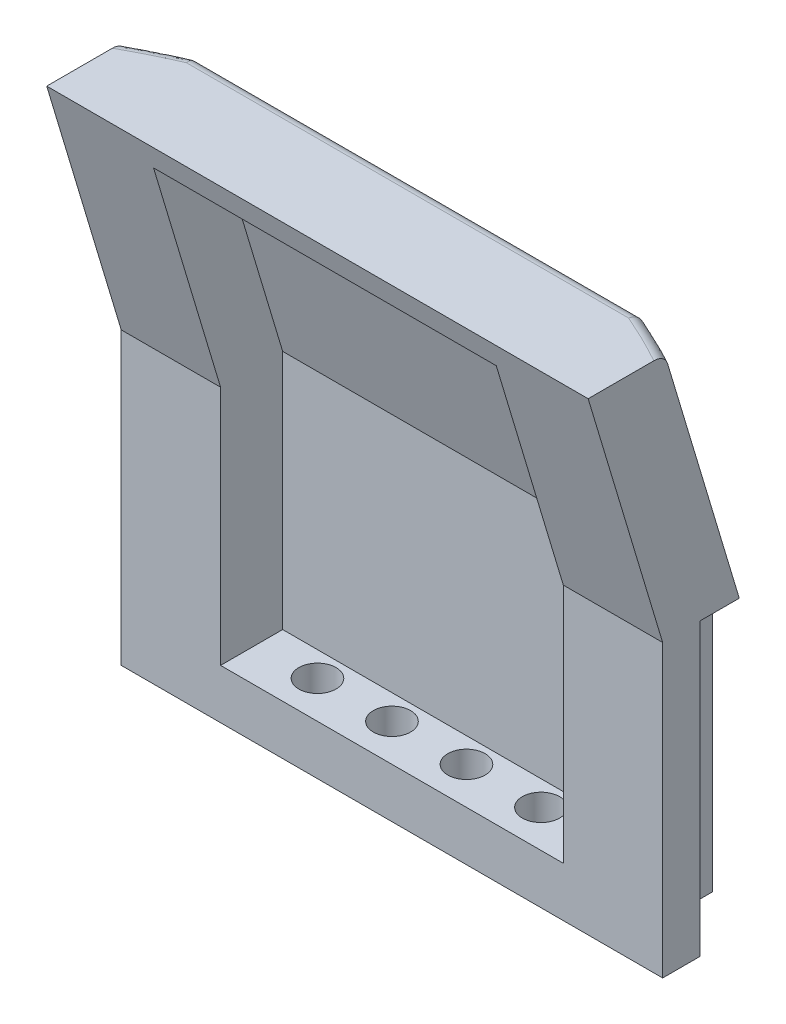
from build123d import *

# Parameters (mm, degrees)
SKETCH1_R                       = 0.75
BOSS_EXTRUDE1_DEPTH             = 1.7
SKETCH1_4_R                     = 1
BOSS_EXTRUDE2_DEPTH             = 0.3
BOSS_EXTRUDE3_DEPTH             = 11.4
BOSS_EXTRUDE4_REACH             = 24.984
CUT_EXTRUDE1_DEPTH              = 15.8
BOSS_EXTRUDE5_DEPTH             = 2
BOSS_EXTRUDE6_DEPTH             = 2
CUT_EXTRUDE4_DEPTH              = 10
CUT_EXTRUDE4_DEPTH_BACK         = 12
BOSS_EXTRUDE7_REACH             = 31.456
BOSS_EXTRUDE7_DIRECTION_2_REACH = 31.456
FILLET1_R                       = 0.5


with BuildPart() as part:
    # Sketch1 → Boss-Extrude1 (new body)
    with BuildSketch(Plane(origin=(0, 0, 0), x_dir=(1, 0, 0), z_dir=(0, 1, 0))):
        Polygon((13.4, 2.5), (-4.4, 2.5), (-4.4, 0), (-6.4, 0), (-6.4, -1.5), (15.4, -1.5), (15.4, 0), (13.4, 0), align=None)
        with Locations(Location((3, 0, 0), (0, 0, 270))):
            Circle(SKETCH1_R, mode=Mode.SUBTRACT)
        with Locations(Location((6, 0, 0), (0, 0, 270))):
            Circle(SKETCH1_R, mode=Mode.SUBTRACT)
        with Locations(Location((9, 0, 0), (0, 0, 270))):
            Circle(SKETCH1_R, mode=Mode.SUBTRACT)
        with Locations(Location((0, 0, 0), (0, 0, 270))):
            Circle(SKETCH1_R, mode=Mode.SUBTRACT)
    extrude(amount=BOSS_EXTRUDE1_DEPTH)

    # Sketch1<4> → Boss-Extrude2 (add)
    with BuildSketch(Plane(origin=(0, 0, 0), x_dir=(1, 0, 0), z_dir=(0, 1, 0))):
        Polygon((13.4, 2.5), (-4.4, 2.5), (-4.4, 0), (-6.4, 0), (-6.4, -1.5), (15.4, -1.5), (15.4, 0), (13.4, 0), align=None)
        with Locations(Location((0, 0, 0), (0, 0, 270))):
            Circle(SKETCH1_4_R, mode=Mode.SUBTRACT)
        with Locations(Location((3, 0, 0), (0, 0, 270))):
            Circle(SKETCH1_4_R, mode=Mode.SUBTRACT)
        with Locations(Location((6, 0, 0), (0, 0, 270))):
            Circle(SKETCH1_4_R, mode=Mode.SUBTRACT)
        with Locations(Location((9, 0, 0), (0, 0, 270))):
            Circle(SKETCH1_4_R, mode=Mode.SUBTRACT)
    extrude(amount=-BOSS_EXTRUDE2_DEPTH)

    # Sketch1<7> → Boss-Extrude3 (add)
    with BuildSketch(Plane(origin=(0, 0, 0), x_dir=(1, 0, 0), z_dir=(0, 1, 0))):
        Polygon((13.4, 1), (13.4, 2.5), (-4.4, 2.5), (-4.4, 1), (-2.4, 1), (0, 1), (3, 1), (6, 1), (9.000000004, 1), (11.4, 1), align=None)
        Polygon((-2.4, 1), (-4.4, 1), (-4.4, 0), (-6.4, 0), (-6.4, -1.5), (-2.4, -1.5), align=None)
        Polygon((13.4, 0), (13.4, 1), (11.4, 1), (11.4, -1.5), (15.4, -1.5), (15.4, 0), align=None)
    extrude(amount=BOSS_EXTRUDE3_DEPTH)

    # Boss-Extrude4: up to this face of the body (flat: up to its plane)
    boss_extrude4_end = Plane(part.part.faces().sort_by_distance((15.4, 5.55, 0.75))[0])
    # Sketch2 → Boss-Extrude4 (add, up to the picked face)
    with BuildSketch(Plane.ZY.offset(4.4), mode=Mode.PRIVATE) as boss_extrude4_sk1:
        Polygon((0.5, 21.4), (-2.5, 11.4), (1.5, 11.4), (4.2, 20.4), (1.7, 20.4), (2, 21.4), align=None)
    boss_extrude4_tool1 = split(extrude(boss_extrude4_sk1.sketch, amount=-BOSS_EXTRUDE4_REACH, mode=Mode.PRIVATE), bisect_by=boss_extrude4_end, keep=Keep.BOTH, mode=Mode.PRIVATE)
    add(boss_extrude4_tool1.solids().sort_by(Axis((-4.4, 16.1, 0.86), (1, 0, 0)))[0])

    # Sketch2<5> → Cut-Extrude1 (cut)
    with BuildSketch(Plane.ZY.offset(4.4)):
        Polygon((1.7, 20.4), (-1, 11.4), (1.5, 11.4), (4.2, 20.4), align=None)
    extrude(amount=-CUT_EXTRUDE1_DEPTH, mode=Mode.SUBTRACT)

    # Sketch2<6> → Boss-Extrude5 (add)
    with BuildSketch(Plane.ZY.offset(4.4)):
        Polygon((1.7, 20.4), (-1, 11.4), (1.5, 11.4), (4.2, 20.4), align=None)
    extrude(amount=-BOSS_EXTRUDE5_DEPTH)

    # Sketch2<7> → Boss-Extrude6 (add)
    with BuildSketch(Plane.ZY.offset(4.4)):
        Polygon((0.5, 21.4), (-2.5, 11.4), (1.5, 11.4), (4.2, 20.4), (1.7, 20.4), (2, 21.4), align=None)
    extrude(amount=BOSS_EXTRUDE6_DEPTH)

    # Sketch5 → Cut-Extrude4 (cut, two sides: drawn at the far end of the back side and taken through both)
    with BuildSketch(Plane(origin=(0, 19.770642202, 5.931192661), x_dir=(1, 0, 0), z_dir=(0, 0.9578262852211515, 0.2873478855663452)).offset(-CUT_EXTRUDE4_DEPTH_BACK)):
        with BuildLine():
            ThreePointArc((-6.6, 4.689132716), (-5.561967393, 5.205345242), (-4.5, 5.670331609))
            Line((-4.5, 5.670331609), (-17.5, 5.670331609))
            Line((-17.5, 5.670331609), (-17.5, -7.329668391))
            ThreePointArc((-17.5, -7.329668391), (-17.035013633, -6.267700999), (-16.518801108, -5.229668391))
            ThreePointArc((-16.518801108, -5.229668391), (-12.307736314, 0.478067922), (-6.6, 4.689132716))
        make_face()
        with BuildLine():
            ThreePointArc((25.518801108, -5.229668391), (26.035013633, -6.267700999), (26.5, -7.329668391))
            Line((26.5, -7.329668391), (26.5, 5.670331609))
            Line((26.5, 5.670331609), (13.5, 5.670331609))
            ThreePointArc((13.5, 5.670331609), (14.561967393, 5.205345242), (15.6, 4.689132716))
            ThreePointArc((15.6, 4.689132716), (21.307736314, 0.478067922), (25.518801108, -5.229668391))
        make_face()
    extrude(amount=CUT_EXTRUDE4_DEPTH + CUT_EXTRUDE4_DEPTH_BACK, mode=Mode.SUBTRACT)

    # Boss-Extrude7: up to this face of the body (flat: up to its plane)
    boss_extrude7_end = Plane(part.part.faces().sort_by_distance((-6.4, 12.005993792, 1.097626434))[0])
    # Sketch2<8> → Boss-Extrude7 (add, up to the picked face)
    with BuildSketch(Plane.ZY.offset(4.4), mode=Mode.PRIVATE) as boss_extrude7_sk1:
        Polygon((4.5, 21.4), (2, 21.4), (1.7, 20.4), (4.2, 20.4), align=None)
    boss_extrude7_tool1 = split(extrude(boss_extrude7_sk1.sketch, amount=BOSS_EXTRUDE7_REACH, mode=Mode.PRIVATE), bisect_by=boss_extrude7_end, keep=Keep.BOTH, mode=Mode.PRIVATE)
    add(boss_extrude7_tool1.solids().sort_by(Axis((-4.4, 20.9, 3.1), (-1, 0, 0)))[0])

    # Boss-Extrude7 direction 2: up to this face of the body (flat: up to its plane)
    boss_extrude7_direction_2_end = Plane(part.part.faces().sort_by_distance((15.4, 12.005993792, 1.097626434))[0])
    # Sketch2<8> → Boss-Extrude7 direction 2 (add, up to the picked face)
    with BuildSketch(Plane.ZY.offset(4.4), mode=Mode.PRIVATE) as boss_extrude7_direction_2_sk1:
        Polygon((4.5, 21.4), (2, 21.4), (1.7, 20.4), (4.2, 20.4), align=None)
    boss_extrude7_direction_2_tool1 = split(extrude(boss_extrude7_direction_2_sk1.sketch, amount=-BOSS_EXTRUDE7_DIRECTION_2_REACH, mode=Mode.PRIVATE), bisect_by=boss_extrude7_direction_2_end, keep=Keep.BOTH, mode=Mode.PRIVATE)
    add(boss_extrude7_direction_2_tool1.solids().sort_by(Axis((-4.4, 20.9, 3.1), (1, 0, 0)))[0])

    # Fillet1
    fillet1_edges = [part.edges().sort_by_distance(p)[0] for p in [
        (4.5, 21.4, 0.5),
        (14.46035786, 21.4, 0.936198075),
        (-5.46035786, 21.4, 0.936198075),
    ]]
    fillet(fillet1_edges, radius=FILLET1_R)


solid = part.part
